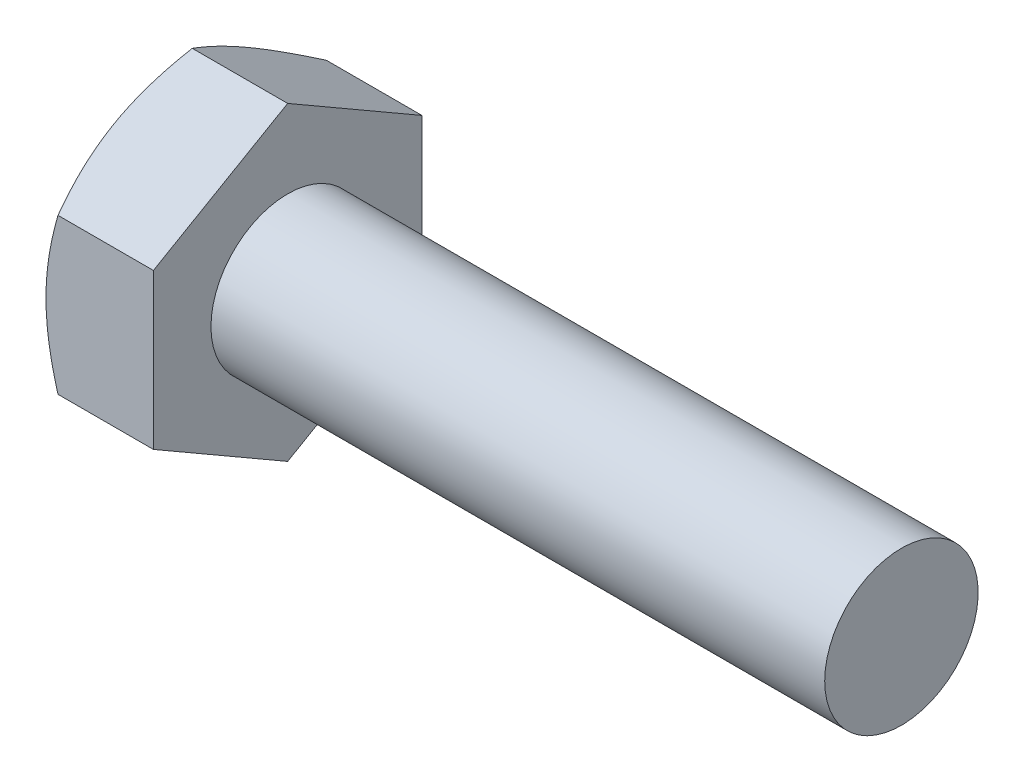
from build123d import *

# Parameters (mm, degrees)
BASEHEAD_DEPTH = 2.8
BODYSKE_W      = 18.8
BODYSKE_H      = 2


with BuildPart() as part:
    # Sketch1 → BaseHead (new body)
    with BuildSketch(Plane(origin=(0, 0, 0), x_dir=(0, 0, -1), z_dir=(1, 0, 0))):
        Polygon((3.5, 2.020725942), (3.5, -2.020725942), (0, -4.041451884), (-3.5, -2.020725942), (-3.5, 2.020725942), (0, 4.041451884), align=None)
    extrude(amount=BASEHEAD_DEPTH)

    # BodySke → BaseBody (revolve)
    with BuildSketch(Plane.XY, mode=Mode.PRIVATE) as basebody_sk:
        with Locations((9.4, 1)):
            Rectangle(BODYSKE_W, BODYSKE_H)
    revolve(basebody_sk.sketch.rotate(Axis((0, 0, 0), (1, 0, 0)), 90), axis=Axis((0, 0, 0), (1, 0, 0)))

    # Sketch3 → HeadChamfer (revolve, cut)
    with BuildSketch(Plane.XY):
        Polygon((0, 3.5), (3.199358737, 9.041451884), (3.199358737, 14.041451884), (-10, 14.041451884), (-10, 3.5), align=None)
    revolve(axis=Axis((0, 0, 0), (1, 0, 0)), mode=Mode.SUBTRACT)


solid = part.part
